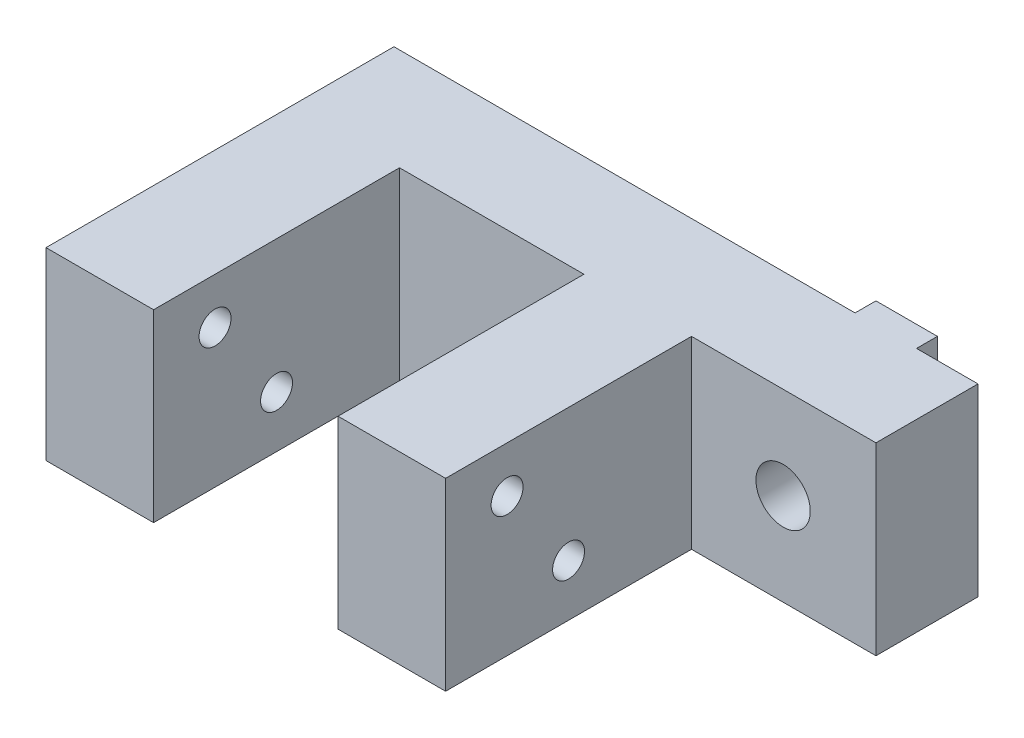
from build123d import *

# Parameters (mm, degrees)
EXTRUDE1_DEPTH         = 9.525
M4X0_7_TAPPED_HOLE1_D  = 3.3
F_10_CLEARANCE_HOLE1_D = 5.6134


with BuildPart() as part:
    # Sketch1 → Extrude1 (new, symmetric)
    with BuildSketch(Plane(origin=(0, 0, 0), x_dir=(1, 0, 0), z_dir=(0, 1, 0))):
        Polygon((47.625, 0), (53.975, 0), (53.975, -2.159), (60.325, -2.159), (60.325, -12.7), (41.275, -12.7), (41.275, -38.1), (30.1625, -38.1), (30.1625, -12.7), (11.1125, -12.7), (11.1125, -38.1), (0, -38.1), (0, -2.159), (47.625, -2.159), align=None)
    extrude(amount=EXTRUDE1_DEPTH, both=True)

    # M4x0.7 Tapped Hole1 (through all)
    with Locations(Plane(origin=(41.275, 0, 0), x_dir=(0, 0, -1), z_dir=(1, 0, 0))):
        with Locations((-31.75, 4.7625), (-25.4, -4.1783)):
            Hole(M4X0_7_TAPPED_HOLE1_D / 2)

    # #10 Clearance Hole1 (through all)
    with Locations(Plane(origin=(0, 0, 0), x_dir=(-1, 0, 0), z_dir=(0, 0, -1))):
        with Locations((-50.7365, 0)):
            Hole(F_10_CLEARANCE_HOLE1_D / 2)


solid = part.part
